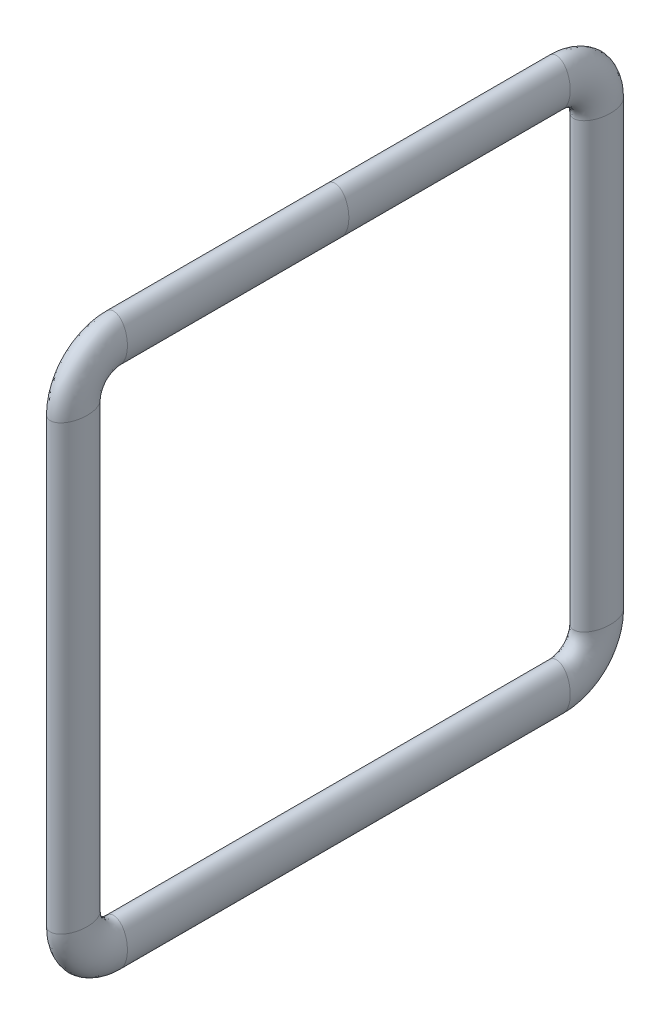
from build123d import *

# Parameters (mm, degrees)
SKETCH_4_RX = 2
SKETCH_4_RY = 1.2


with BuildPart() as part:
    # ｽｲｰﾌﾟ1: sweep along a path in ｽｹｯﾁ3
    with BuildLine(Plane(origin=(0, 0, 0), x_dir=(0, 0, -1), z_dir=(1, 0, 0))) as sweep_1_path:
        Line((-19.25, 22.75), (19.25, 22.75))
        ThreePointArc((19.25, 22.75), (21.724873734, 21.724873734), (22.75, 19.25))
        Line((22.75, 19.25), (22.75, -19.25))
        ThreePointArc((22.75, -19.25), (21.724873734, -21.724873734), (19.25, -22.75))
        Line((19.25, -22.75), (-19.25, -22.75))
        ThreePointArc((-19.25, -22.75), (-21.724873734, -21.724873734), (-22.75, -19.25))
        Line((-22.75, -19.25), (-22.75, 19.25))
        ThreePointArc((-22.75, 19.25), (-21.724873734, 21.724873734), (-19.25, 22.75))
    # ｽｹｯﾁ4 → ｽｲｰﾌﾟ1 (sweep)
    with BuildSketch(Plane.XY):
        with Locations(Location((0, 22.75), (0, 0, 90))):
            Ellipse(SKETCH_4_RX, SKETCH_4_RY)
    sweep(path=sweep_1_path.line)


solid = part.part
